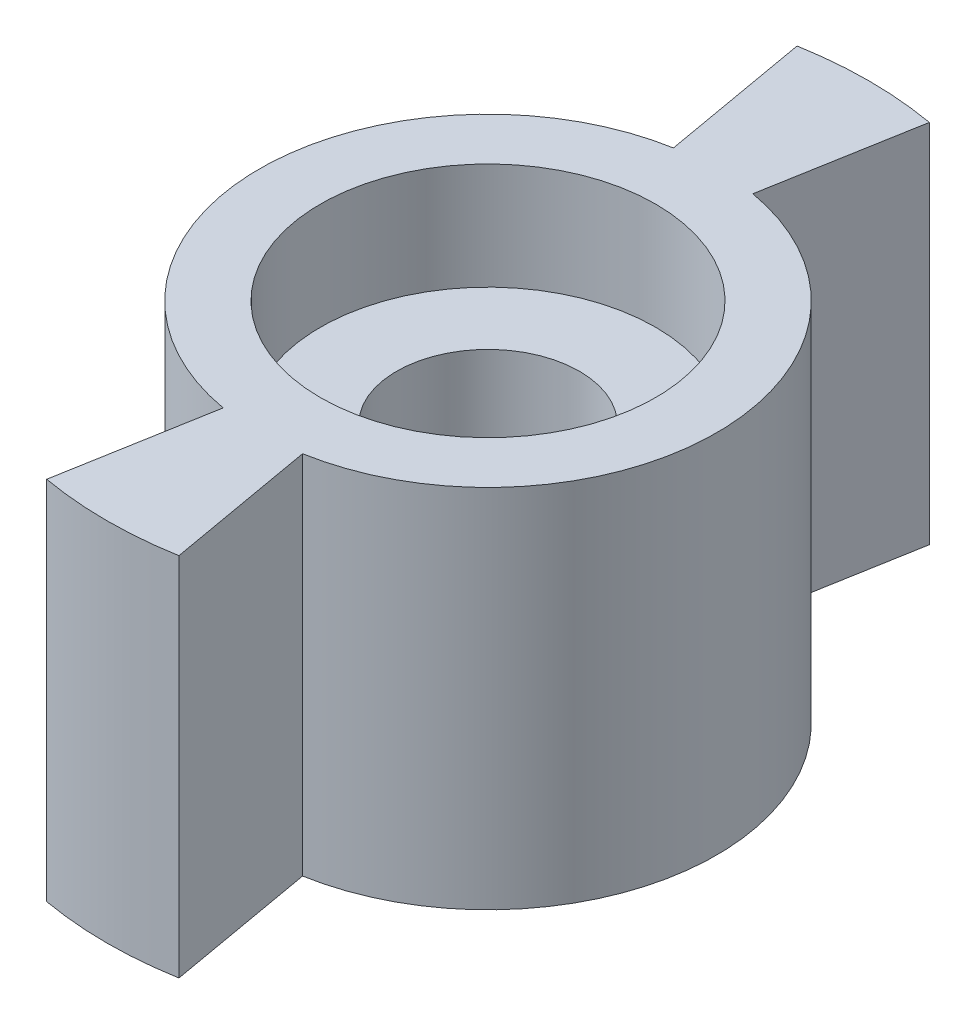
from build123d import *

# Parameters (mm, degrees)
CUT_EXTRUDE2_START = -100
CUT_EXTRUDE2_DEPTH = 100


with BuildPart() as part:
    # Sketch1 → Revolve1 (revolve)
    with BuildSketch(Plane.XY, mode=Mode.PRIVATE) as revolve1_sk:
        Polygon((25, 24), (25, 4.595744681), (25, 0), (11, 0), (11, 7), (6, 7), (6, 17), (11, 17), (11, 24), align=None)
    revolve(revolve1_sk.sketch.rotate(Axis((0, 0, 0), (0, 1, 0)), 90), axis=Axis((0, 0, 0), (0, 1, 0)))

    # Sketch2 → Cut-Extrude2 (cut)
    with BuildSketch(Plane(origin=(0, 24, 0), x_dir=(1, 0, 0), z_dir=(0, 1, 0)).offset(CUT_EXTRUDE2_START)):
        with BuildLine():
            Line((4.341204442, 24.620193825), (2.604722665, 14.772116295))
            ThreePointArc((2.604722665, 14.772116295), (10.606601718, 10.606601718), (14.772116295, 2.604722665))
            Line((14.772116295, 2.604722665), (24.620193825, 4.341204442))
            ThreePointArc((24.620193825, 4.341204442), (17.67766953, 17.67766953), (4.341204442, 24.620193825))
        make_face()
        with BuildLine():
            ThreePointArc((15, 0), (14.942920471, -1.307336141), (14.772116295, -2.604722665))
            Line((14.772116295, -2.604722665), (24.620193825, -4.341204442))
            ThreePointArc((24.620193825, -4.341204442), (24.904867452, -2.178893569), (25, 0))
            ThreePointArc((25, 0), (24.904867452, 2.178893569), (24.620193825, 4.341204442))
            Line((24.620193825, 4.341204442), (14.772116295, 2.604722665))
            ThreePointArc((14.772116295, 2.604722665), (14.942920471, 1.307336141), (15, 0))
        make_face()
        with BuildLine():
            Line((24.620193825, -4.341204442), (14.772116295, -2.604722665))
            ThreePointArc((14.772116295, -2.604722665), (10.606601718, -10.606601718), (2.604722665, -14.772116295))
            Line((2.604722665, -14.772116295), (4.341204442, -24.620193825))
            ThreePointArc((4.341204442, -24.620193825), (17.67766953, -17.67766953), (24.620193825, -4.341204442))
        make_face()
        with BuildLine():
            Line((-4.341204442, -24.620193825), (-2.604722665, -14.772116295))
            ThreePointArc((-2.604722665, -14.772116295), (-10.606601718, -10.606601718), (-14.772116295, -2.604722665))
            Line((-14.772116295, -2.604722665), (-24.620193825, -4.341204442))
            ThreePointArc((-24.620193825, -4.341204442), (-17.67766953, -17.67766953), (-4.341204442, -24.620193825))
        make_face()
        with BuildLine():
            ThreePointArc((-14.772116295, -2.604722665), (-15, 0), (-14.772116295, 2.604722665))
            Line((-14.772116295, 2.604722665), (-24.620193825, 4.341204442))
            ThreePointArc((-24.620193825, 4.341204442), (-25, 0), (-24.620193825, -4.341204442))
            Line((-24.620193825, -4.341204442), (-14.772116295, -2.604722665))
        make_face()
        with BuildLine():
            ThreePointArc((-14.772116295, 2.604722665), (-10.606601718, 10.606601718), (-2.604722665, 14.772116295))
            Line((-2.604722665, 14.772116295), (-4.341204442, 24.620193825))
            ThreePointArc((-4.341204442, 24.620193825), (-17.67766953, 17.67766953), (-24.620193825, 4.341204442))
            Line((-24.620193825, 4.341204442), (-14.772116295, 2.604722665))
        make_face()
    extrude(amount=CUT_EXTRUDE2_DEPTH, mode=Mode.SUBTRACT)


solid = part.part
